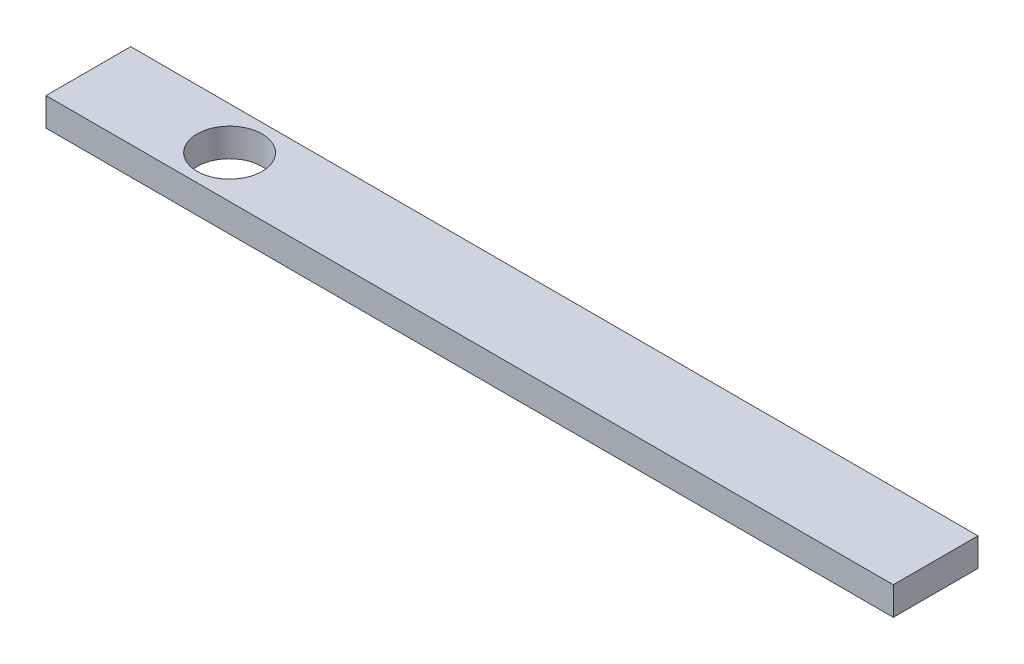
from build123d import *

# Parameters (mm, degrees)
SKETCH1_W           = 76.2
SKETCH1_H           = 7.62
SKETCH1_R           = 2.921
BOSS_EXTRUDE1_DEPTH = 2.54


with BuildPart() as part:
    # Sketch1 → Boss-Extrude1 (new body)
    with BuildSketch(Plane(origin=(0, 0, 0), x_dir=(1, 0, 0), z_dir=(0, 1, 0))):
        with Locations((38.1, 3.81)):
            Rectangle(SKETCH1_W, SKETCH1_H)
        with Locations(Location((12.7, 3.81, 0), (0, 0, 270))):
            Circle(SKETCH1_R, mode=Mode.SUBTRACT)
    extrude(amount=BOSS_EXTRUDE1_DEPTH)


solid = part.part
